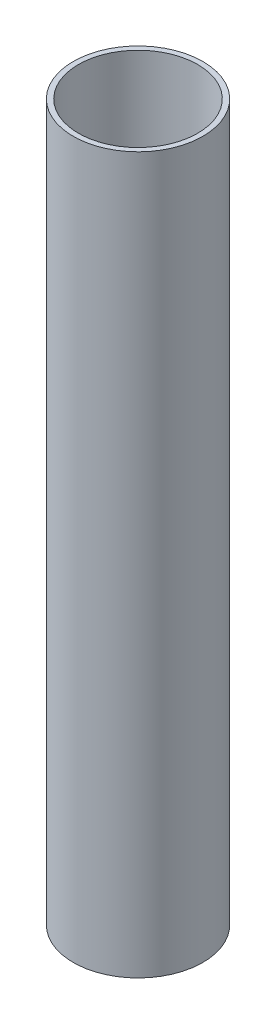
from build123d import *

# Parameters (mm, degrees)
SKETCH1_R           = 27.6225
SKETCH1_R_2         = 25.4
BOSS_EXTRUDE1_DEPTH = 304.8


with BuildPart() as part:
    # Sketch1 → Boss-Extrude1 (new body)
    with BuildSketch(Plane(origin=(0, 0, 0), x_dir=(1, 0, 0), z_dir=(0, 1, 0))):
        with Locations(Location((0, 0, 0), (0, 0, 90))):
            Circle(SKETCH1_R)
        with Locations(Location((0, 0, 0), (0, 0, 90))):
            Circle(SKETCH1_R_2, mode=Mode.SUBTRACT)
    extrude(amount=BOSS_EXTRUDE1_DEPTH)


solid = part.part
